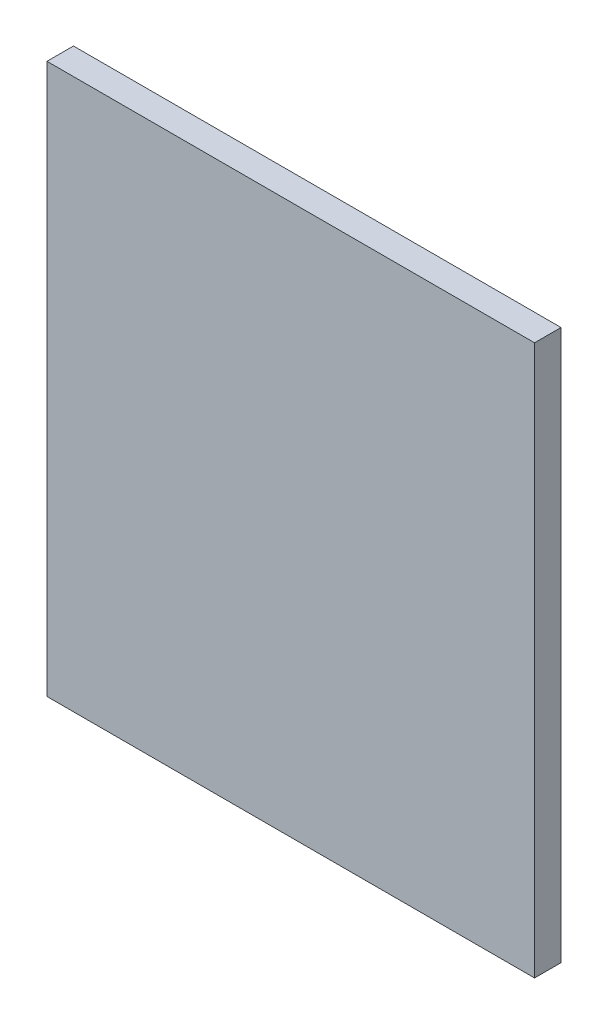
from build123d import *

# Parameters (mm, degrees)
CROQUIS1_W              = 1104.553324203
CROQUIS1_H              = 1246.23
SALIENTE_EXTRUIR1_DEPTH = 60


with BuildPart() as part:
    # Croquis1 → Saliente-Extruir1 (new body)
    with BuildSketch(Plane.XY):
        with Locations((-260.923318408, -195.003071672)):
            Rectangle(CROQUIS1_W, CROQUIS1_H)
    extrude(amount=SALIENTE_EXTRUIR1_DEPTH)


solid = part.part
